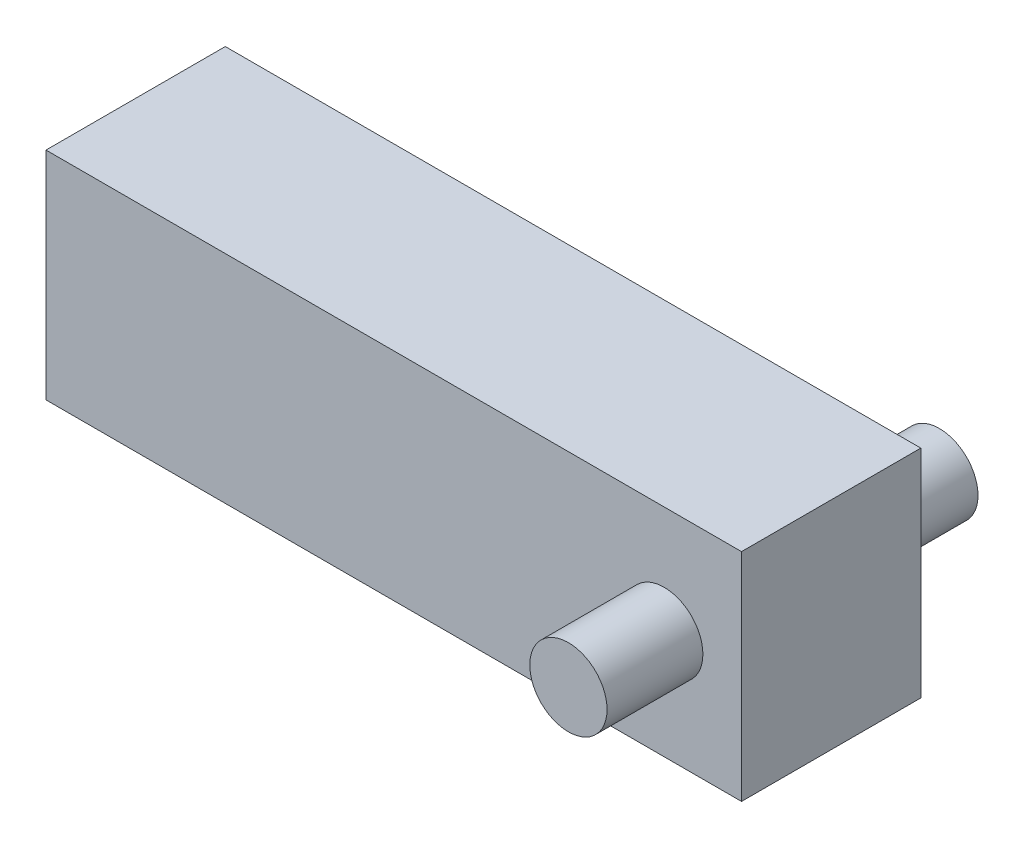
from build123d import *

# Parameters (mm, degrees)
EXTRUDE1_DEPTH           = 3.683
EXTRUDE1_DEPTH_BACK      = 3.683
BOSS_EXTRUDE1_DEPTH      = 7.62
BOSS_EXTRUDE1_DEPTH_BACK = 7.62
SKETCH4_R                = 1.5875


with BuildPart() as part:
    # Sketch1 → Extrude1 (new, two sides: drawn at the far end of the back side and taken through both)
    with BuildSketch(Plane.XY.offset(-EXTRUDE1_DEPTH_BACK)):
        Polygon((-12.7, 4.445), (12.7, 4.445), (15.875, 4.445), (15.875, -4.445), (12.7, -4.445), (-12.7, -4.445), align=None)
    extrude(amount=EXTRUDE1_DEPTH + EXTRUDE1_DEPTH_BACK)

    # Sketch4 → Boss-Extrude1 (add, two sides: drawn at the far end of the back side and taken through both)
    with BuildSketch(Plane.XY.offset(-BOSS_EXTRUDE1_DEPTH_BACK)):
        with Locations((12.7, 0)):
            Circle(SKETCH4_R)
    extrude(amount=BOSS_EXTRUDE1_DEPTH + BOSS_EXTRUDE1_DEPTH_BACK)


solid = part.part
